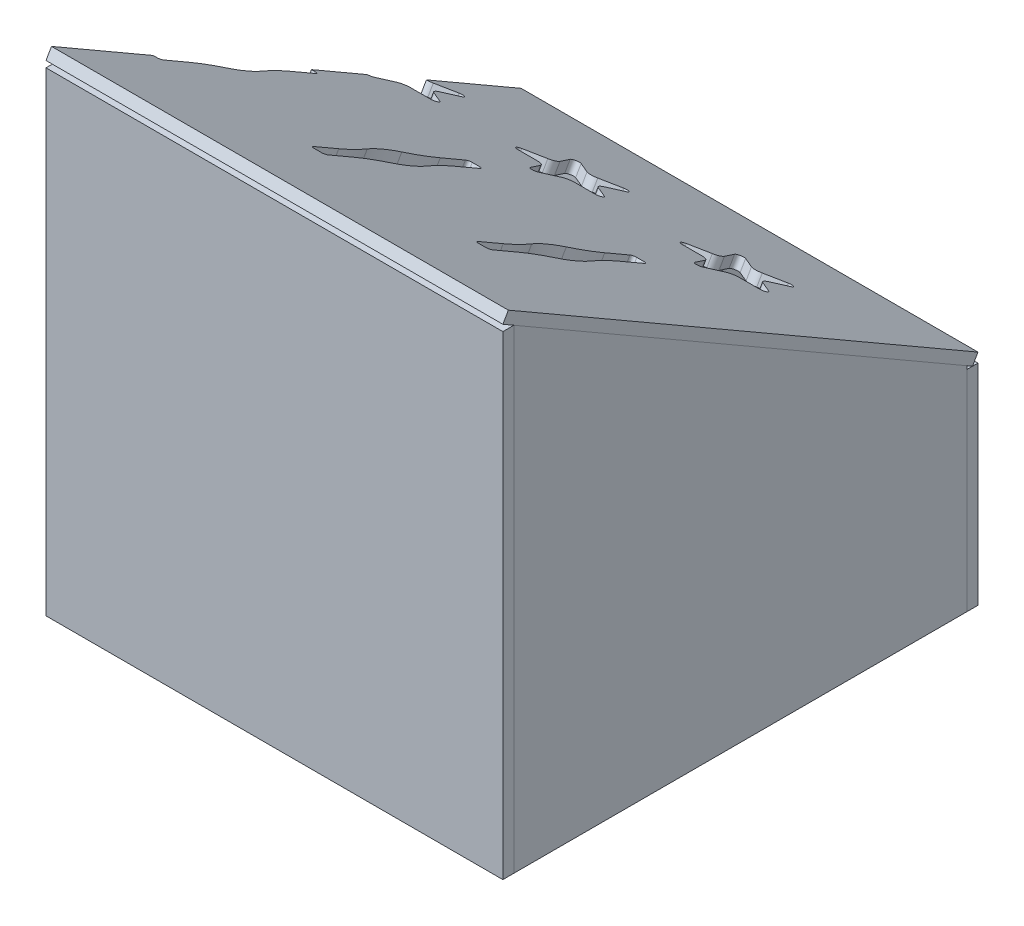
from build123d import *

# Parameters (mm, degrees)
ESQUISSE3_W                      = 122
ESQUISSE3_H                      = 124
PLQ_BASE_DEPTH                   = 3
ESQUISSE4_W                      = 125
ESQUISSE4_H                      = 129.859382572
PLQ_ARRIERE_DEPTH                = 3
ESQUISSE5_W                      = 125
ESQUISSE5_H                      = 57.401923789
PLQ_AVANT_DEPTH                  = 3
ESQUISSE6_W                      = 148.379019182
ESQUISSE6_H                      = 125
PLQ_PANNEAU_DESSUS_DEPTH         = 3
PLQ_COTE_START                   = 125
PLQ_COTE_DEPTH                   = 3
ETOILE_1_DEPTH                   = 219.882997902
ESQUISSE9_RX                     = 10
ESQUISSE9_RY                     = 4
FENTE_1_DEPTH                    = 219.882997902
CONG_1_R                         = 42
R_P_TITION_LIN_AIRE2_COUNT       = 3
R_P_TITION_LIN_AIRE2_PITCH       = 45
CONG_1_OF_R_P_TITION_LIN_AIRE2_R = 42
SEPARATEUR_1_START               = 67.5
ESQUISSE10_W                     = 3
ESQUISSE10_H                     = 20
ESQUISSE10_W_2                   = 20
ESQUISSE10_H_2                   = 3
ESQUISSE10_H_3                   = 12
SEPARATEUR_1_DEPTH               = 1.5


with BuildPart() as part:
    # Esquisse3 → plq_base (new body)
    with BuildSketch(Plane(origin=(0, 0, 0), x_dir=(1, 0, 0), z_dir=(0, 1, 0))):
        with Locations((61, -65)):
            Rectangle(ESQUISSE3_W, ESQUISSE3_H)
    extrude(amount=PLQ_BASE_DEPTH)


with BuildPart() as body_2:
    # Esquisse4 → plq_arriere (new body)
    with BuildSketch(Plane.XY.offset(130)):
        with Locations((62.5, 64.929691286)):
            Rectangle(ESQUISSE4_W, ESQUISSE4_H)
    extrude(amount=-PLQ_ARRIERE_DEPTH)


with BuildPart() as body_3:
    # Esquisse5 → plq_avant (new body)
    with BuildSketch(Plane.XY):
        with Locations((62.5, 28.700961895)):
            Rectangle(ESQUISSE5_W, ESQUISSE5_H)
    extrude(amount=PLQ_AVANT_DEPTH)


with BuildPart() as body_4:
    # Esquisse6 → plq_panneau (dessus) (new body)
    with BuildSketch(Plane(origin=(0, 45, -25.980762114), x_dir=(0, -0.4999999999999976, -0.86602540378444), z_dir=(0, -0.86602540378444, 0.4999999999999976))):
        with Locations((-104.189509591, 62.5)):
            Rectangle(ESQUISSE6_W, ESQUISSE6_H)
    extrude(amount=PLQ_PANNEAU_DESSUS_DEPTH)

    # Esquisse8 → etoile_1 (cut, through all)
    with BuildSketch(Plane(origin=(0, 45, -25.980762114), x_dir=(0, -0.4999999999999976, -0.86602540378444), z_dir=(0, -0.86602540378444, 0.4999999999999976))):
        with BuildLine():
            Line((-72.60626896, 92.806424854), (-77.73109535, 91.14126782))
            ThreePointArc((-77.73109535, 91.14126782), (-78.560274957, 90), (-77.73109535, 88.85873218))
            Line((-77.73109535, 88.85873218), (-72.60626896, 87.193575146))
            ThreePointArc((-72.60626896, 87.193575146), (-71.35626896, 86.285396986), (-70.878811445, 84.815933856))
            Line((-70.878811445, 84.815933856), (-70.878811445, 79.4273725))
            ThreePointArc((-70.878811445, 79.4273725), (-70.049631839, 78.286104681), (-68.707991052, 78.722030197))
            Line((-68.707991052, 78.722030197), (-65.540674156, 83.081467909))
            ThreePointArc((-65.540674156, 83.081467909), (-64.290674156, 83.989646069), (-62.745589185, 83.989646069))
            Line((-62.745589185, 83.989646069), (-57.620762794, 82.324489035))
            ThreePointArc((-57.620762794, 82.324489035), (-56.279122007, 82.760414552), (-56.279122007, 84.171099157))
            Line((-56.279122007, 84.171099157), (-59.446438903, 88.530536869))
            ThreePointArc((-59.446438903, 88.530536869), (-59.923896417, 90), (-59.446438903, 91.469463131))
            Line((-59.446438903, 91.469463131), (-56.279122007, 95.828900843))
            ThreePointArc((-56.279122007, 95.828900843), (-56.279122007, 97.239585448), (-57.620762794, 97.675510965))
            Line((-57.620762794, 97.675510965), (-62.745589185, 96.010353931))
            ThreePointArc((-62.745589185, 96.010353931), (-64.290674156, 96.010353931), (-65.540674156, 96.918532091))
            Line((-65.540674156, 96.918532091), (-68.707991052, 101.277969803))
            ThreePointArc((-68.707991052, 101.277969803), (-70.049631839, 101.713895319), (-70.878811445, 100.5726275))
            Line((-70.878811445, 100.5726275), (-70.878811445, 95.184066144))
            ThreePointArc((-70.878811445, 95.184066144), (-71.35626896, 93.714603014), (-72.60626896, 92.806424854))
        make_face()
    etoile_1 = extrude(amount=ETOILE_1_DEPTH, mode=Mode.SUBTRACT)

    # Esquisse9 → fente_1 (cut, through all)
    with BuildSketch(Plane(origin=(0, 45, -25.980762114), x_dir=(0, -0.4999999999999976, -0.86602540378444), z_dir=(0, -0.86602540378444, 0.4999999999999976))):
        with Locations(Location((-121.24355653, 90), (0, 0, -180))):
            Ellipse(ESQUISSE9_RX, ESQUISSE9_RY)
        with BuildLine():
            Line((-97.24355653, 88), (-145.24355653, 88))
            ThreePointArc((-145.24355653, 88), (-145.950663311, 88.292893219), (-146.24355653, 89))
            Line((-146.24355653, 89), (-146.24355653, 91))
            ThreePointArc((-146.24355653, 91), (-145.950663311, 91.707106781), (-145.24355653, 92))
            Line((-145.24355653, 92), (-97.24355653, 92))
            ThreePointArc((-97.24355653, 92), (-96.536449749, 91.707106781), (-96.24355653, 91))
            Line((-96.24355653, 91), (-96.24355653, 89))
            ThreePointArc((-96.24355653, 89), (-96.536449749, 88.292893219), (-97.24355653, 88))
        make_face()
    fente_1 = extrude(amount=FENTE_1_DEPTH, mode=Mode.SUBTRACT)

    # Congé1
    cong_1_edges = [body_4.edges().sort_by_distance(p)[0] for p in [
        (88, 108.652867178, 87.269237886),
        (88, 99.99261314, 72.269237886),
        (92, 108.652867178, 87.269237886),
        (92, 99.99261314, 72.269237886),
    ]]
    fillet(cong_1_edges, radius=CONG_1_R)

    # Répétition linéaire2: etoile_1, fente_1 ×3
    with Locations(*[(-i * R_P_TITION_LIN_AIRE2_PITCH, 0, 0) for i in range(1, R_P_TITION_LIN_AIRE2_COUNT)]):
        add(etoile_1, mode=Mode.SUBTRACT)
        add(fente_1, mode=Mode.SUBTRACT)

    # Congé1 of Répétition linéaire2
    cong_1_of_r_p_tition_lin_aire2_edges = [body_4.edges().sort_by_distance(p)[0] for p in [
        (43, 108.652867178, 87.269237886),
        (43, 99.99261314, 72.269237886),
        (47, 108.652867178, 87.269237886),
        (47, 99.99261314, 72.269237886),
        (-2, 108.652867178, 87.269237886),
        (-2, 99.99261314, 72.269237886),
        (2, 108.652867178, 87.269237886),
        (2, 99.99261314, 72.269237886),
    ]]
    fillet(cong_1_of_r_p_tition_lin_aire2_edges, radius=CONG_1_OF_R_P_TITION_LIN_AIRE2_R)


with BuildPart() as body_5:
    # Esquisse7 → plq_cote (new body)
    with BuildSketch(Plane(origin=(0, 0, 0), x_dir=(0, 0, -1), z_dir=(1, 0, 0)).offset(PLQ_COTE_START)):
        Polygon((-127, 129.859382572), (-127, 0), (-3, 0), (-3, 58.267949192), align=None)
    extrude(amount=-PLQ_COTE_DEPTH)


with BuildPart() as body_6:
    # Esquisse10 → separateur_1 (new, symmetric)
    with BuildSketch(Plane(origin=(0, 0, 0), x_dir=(0, 0, -1), z_dir=(1, 0, 0)).offset(SEPARATEUR_1_START)):
        Polygon((-15.237205584, 56.095498823), (-49.878221735, 76.095498823), (-45.878221735, 83.023702054), (-63.198729811, 93.023702054), (-67.198729811, 86.095498823), (-120.892304845, 117.095498823), (-116.892304845, 124.023702054), (-127, 129.859382572), (-127, 3), (-3, 3), (-3, 58.267949192), (-11.237205584, 63.023702054), align=None)
        with Locations((-128.5, 99.859382572)):
            Rectangle(ESQUISSE10_W, ESQUISSE10_H)
        with Locations((-128.5, 33)):
            Rectangle(ESQUISSE10_W, ESQUISSE10_H)
        with Locations((-97, 1.5)):
            Rectangle(ESQUISSE10_W_2, ESQUISSE10_H_2)
        with Locations((-33, 1.5)):
            Rectangle(ESQUISSE10_W_2, ESQUISSE10_H_2)
        with Locations((-1.5, 18)):
            Rectangle(ESQUISSE10_W, ESQUISSE10_H_3)
        with Locations((-1.5, 43.267949192)):
            Rectangle(ESQUISSE10_W, ESQUISSE10_H_3)
    extrude(amount=SEPARATEUR_1_DEPTH, both=True)


solid = Compound([part.part, body_2.part, body_3.part, body_4.part, body_5.part, body_6.part])
